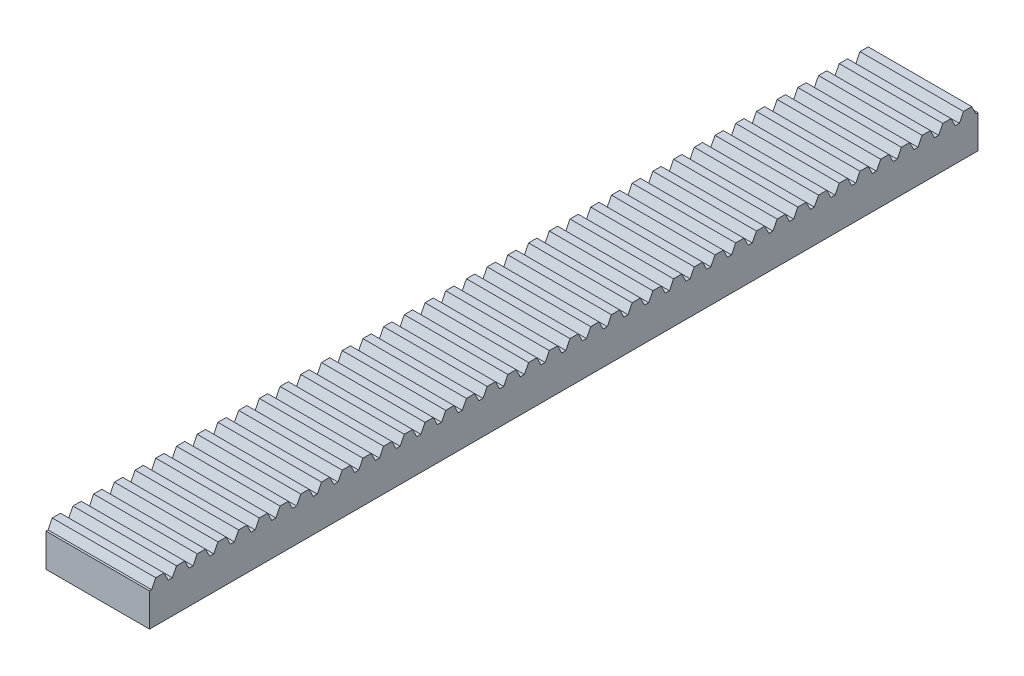
from build123d import *

# Parameters (mm, degrees)
SKETCH1_W           = 50
SKETCH1_H           = 20
BOSS_EXTRUDE1_DEPTH = 400
CUT_EXTRUDE1_START  = -50
CUT_EXTRUDE1_DEPTH  = 50
LPATTERN1_COUNT     = 41
LPATTERN1_PITCH     = 10


with BuildPart() as part:
    # Sketch1 → Boss-Extrude1 (new body)
    with BuildSketch(Plane.XY):
        with Locations((0, 10)):
            Rectangle(SKETCH1_W, SKETCH1_H)
    extrude(amount=BOSS_EXTRUDE1_DEPTH)

    # Sketch2 → Cut-Extrude1 (cut)
    with BuildSketch(Plane(origin=(25, 0, 0), x_dir=(0, 0, -1), z_dir=(1, 0, 0)).offset(CUT_EXTRUDE1_START)):
        Polygon((-403, 20), (-397, 20), (-399, 16), (-401, 16), align=None)
    cut_extrude1 = extrude(amount=CUT_EXTRUDE1_DEPTH, mode=Mode.SUBTRACT)

    # LPattern1: Cut-Extrude1 ×41
    with Locations(*[(0, 0, -i * LPATTERN1_PITCH) for i in range(1, LPATTERN1_COUNT)]):
        add(cut_extrude1, mode=Mode.SUBTRACT)


solid = part.part
